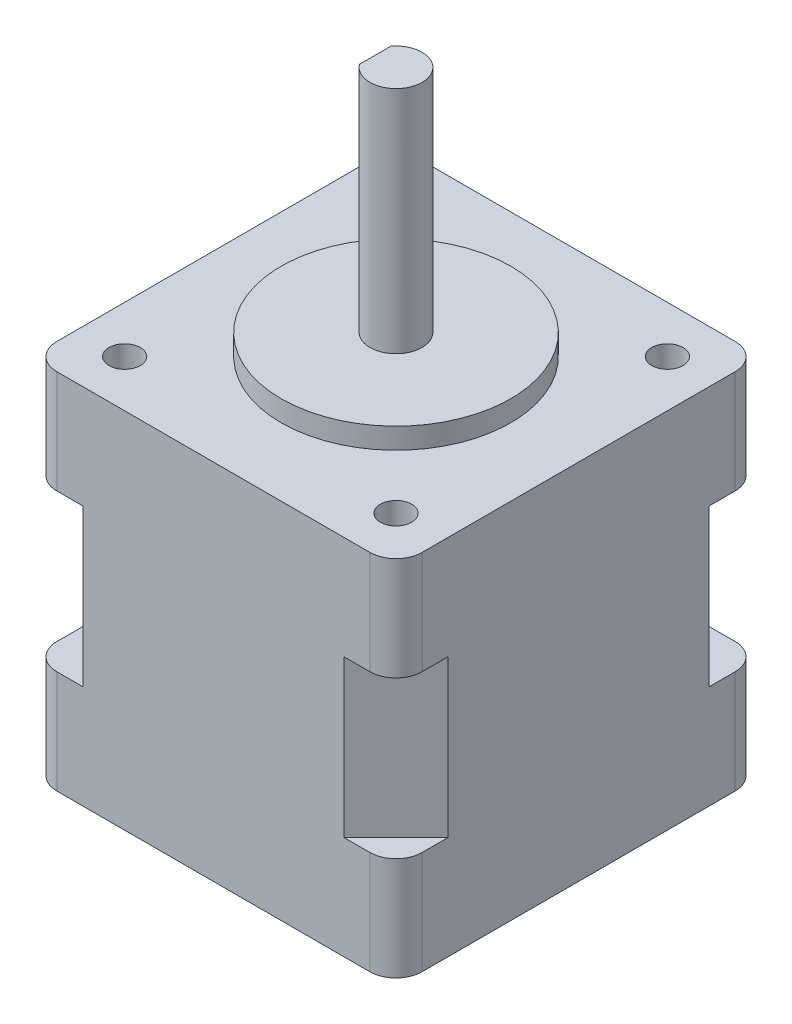
from build123d import *

# Parameters (mm, degrees)
ESQUISSE1_W                       = 35
ESQUISSE1_H                       = 35
BOSS_EXTRU_1_DEPTH                = 34.8
ESQUISSE2_R                       = 11
BOSS_EXTRU_2_DEPTH                = 2
ESQUISSE3_R                       = 2.5
BOSS_EXTRU_3_DEPTH                = 22
ESQUISSE8_W                       = 1.389274908
ESQUISSE8_H                       = 3
ENL_V_MAT_EXTRU_2_DEPTH           = 16.6
DIAM_TRE_DU_PER_AGE_3_0_3_1_D     = 3
DIAM_TRE_DU_PER_AGE_3_0_3_1_DEPTH = 4.2
DIAM_TRE_DU_PER_AGE_3_0_3_1_TIP   = 0.901290929
CONG_1_R                          = 2.5
ENL_V_MAT_EXTRU_1_DEPTH           = 7.5
ESQUISSE5_R                       = 0.7
ESQUISSE5_R_2                     = 0.654723083
BOSS_EXTRU_4_DEPTH                = 10


with BuildPart() as part:
    # Esquisse1 → Boss.-Extru.1 (new body)
    with BuildSketch(Plane(origin=(0, 0, 0), x_dir=(1, 0, 0), z_dir=(0, 1, 0))):
        Rectangle(ESQUISSE1_W, ESQUISSE1_H)
    extrude(amount=BOSS_EXTRU_1_DEPTH)

    # Esquisse2 → Boss.-Extru.2 (add)
    with BuildSketch(Plane(origin=(0, 34.8, 0), x_dir=(1, 0, 0), z_dir=(0, 1, 0))):
        with Locations(Location((0, 0, 0), (0, 0, 270))):
            Circle(ESQUISSE2_R)
    extrude(amount=BOSS_EXTRU_2_DEPTH)

    # Esquisse3 → Boss.-Extru.3 (add)
    with BuildSketch(Plane(origin=(0, 36.8, 0), x_dir=(1, 0, 0), z_dir=(0, 1, 0))):
        with Locations(Location((0, 0, 0), (0, 0, 270))):
            Circle(ESQUISSE3_R)
    extrude(amount=BOSS_EXTRU_3_DEPTH)

    # Esquisse8 → Enlèv. mat.-Extru.2 (cut)
    with BuildSketch(Plane(origin=(0, 58.8, 0), x_dir=(1, 0, 0), z_dir=(0, 1, 0))):
        with Locations((-2.694637454, 0)):
            Rectangle(ESQUISSE8_W, ESQUISSE8_H)
    extrude(amount=-ENL_V_MAT_EXTRU_2_DEPTH, mode=Mode.SUBTRACT)

    # Diamètre du perçage Ø3.0 (3)1
    with Locations(Plane(origin=(0, 34.8, 0), x_dir=(1, 0, 0), z_dir=(0, 1, 0))):
        with Locations((-13, 13), (13, 13), (13, -13), (-13, -13)):
            Hole(DIAM_TRE_DU_PER_AGE_3_0_3_1_D / 2, depth=DIAM_TRE_DU_PER_AGE_3_0_3_1_DEPTH)
            with Locations((0, 0, -(DIAM_TRE_DU_PER_AGE_3_0_3_1_DEPTH + DIAM_TRE_DU_PER_AGE_3_0_3_1_TIP / 2))):  # 118° drill point
                Cone(0, DIAM_TRE_DU_PER_AGE_3_0_3_1_D / 2, DIAM_TRE_DU_PER_AGE_3_0_3_1_TIP, mode=Mode.SUBTRACT)

    # Congé1
    cong_1_edges = [part.edges().sort_by_distance(p)[0] for p in [
        (-17.5, 17.4, -17.5),
        (17.5, 17.4, -17.5),
        (17.5, 17.4, 17.5),
        (-17.5, 17.4, 17.5),
    ]]
    fillet(cong_1_edges, radius=CONG_1_R)

    # Esquisse4 → Enlèv. mat.-Extru.1 (cut, symmetric)
    with BuildSketch(Plane(origin=(0, 17.4, 0), x_dir=(1, 0, 0), z_dir=(0, 1, 0))):
        Polygon((-12.5, 17.5), (-17.5, 12.5), (-17.5, 17.5), align=None)
        Polygon((17.5, 17.5), (12.5, 17.5), (17.5, 12.5), align=None)
        Polygon((12.5, -17.5), (17.5, -12.5), (17.5, -17.5), align=None)
        Polygon((-17.5, -17.5), (-12.5, -17.5), (-17.5, -12.5), align=None)
    extrude(amount=ENL_V_MAT_EXTRU_1_DEPTH, both=True, mode=Mode.SUBTRACT)

    # Esquisse5 → Boss.-Extru.4 (add)
    with BuildSketch(Plane.ZY.offset(17.5)):
        with Locations(Location((-1, 7, 0), (0, 0, 180))):
            Circle(ESQUISSE5_R)
        with Locations(Location((-1, 5, 0), (0, 0, 180))):
            Circle(ESQUISSE5_R_2)
        with Locations(Location((1, 5, 0), (0, 0, 180))):
            Circle(ESQUISSE5_R_2)
        with Locations(Location((1, 7, 0), (0, 0, 180))):
            Circle(ESQUISSE5_R)
    extrude(amount=BOSS_EXTRU_4_DEPTH)


solid = part.part
